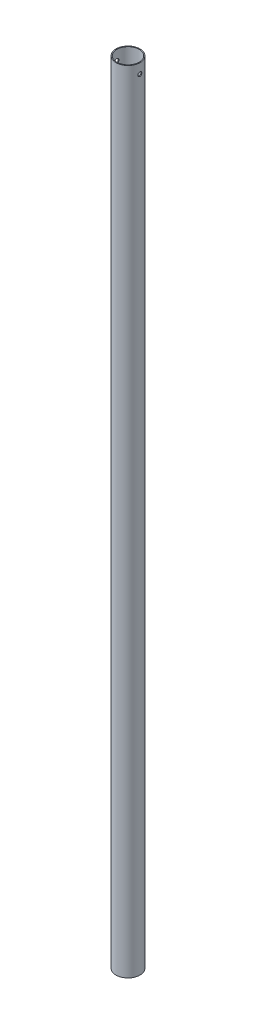
from build123d import *

# Parameters (mm, degrees)
SKETCH1_R               = 30
SKETCH1_R_2             = 28
EXTRUDE_THIN1_DEPTH     = 990.5
CUT_EXTRUDE1_DEPTH      = 992.408215621
CUT_EXTRUDE1_DEPTH_BACK = 992.408215621
SKETCH2_R               = 5


with BuildPart() as part:
    # Sketch1 → Extrude-Thin1 (new, symmetric)
    with BuildSketch(Plane(origin=(0, 0, 0), x_dir=(1, 0, 0), z_dir=(0, 1, 0))):
        Circle(SKETCH1_R)
        Circle(SKETCH1_R_2, mode=Mode.SUBTRACT)
    extrude(amount=EXTRUDE_THIN1_DEPTH, both=True)

    # Sketch2 → Cut-Extrude1 (cut, two sides: drawn at the far end of the back side and taken through both)
    with BuildSketch(Plane(origin=(0, 0, 0), x_dir=(0, 0, -1), z_dir=(1, 0, 0)).offset(-CUT_EXTRUDE1_DEPTH_BACK)):
        with Locations((0, 965.5)):
            Circle(SKETCH2_R)
    extrude(amount=CUT_EXTRUDE1_DEPTH + CUT_EXTRUDE1_DEPTH_BACK, mode=Mode.SUBTRACT)


solid = part.part
